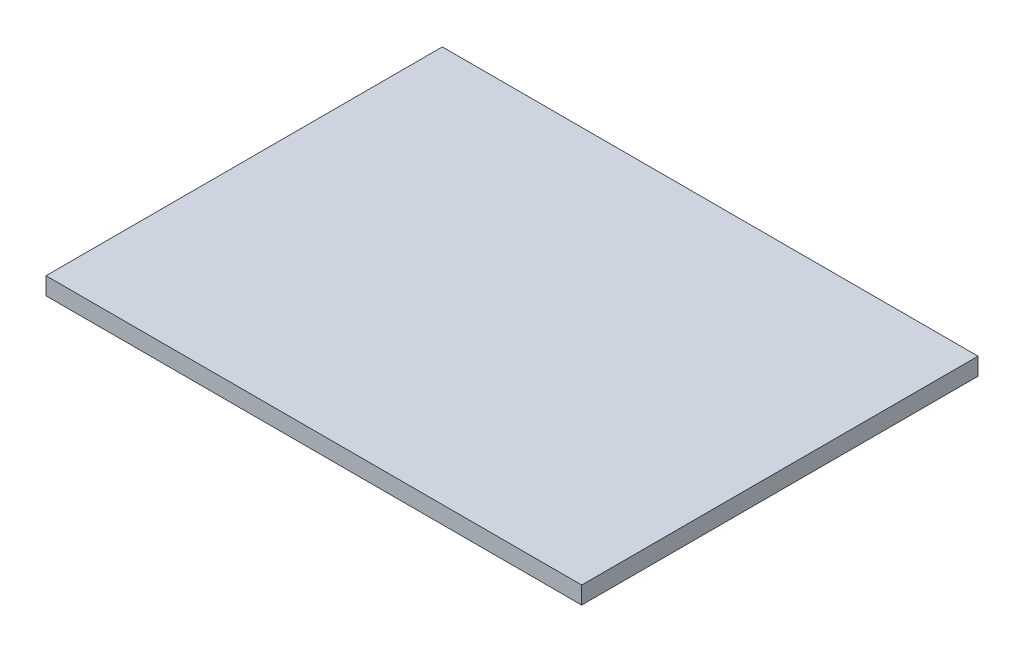
from build123d import *

# Parameters (mm, degrees)
SKETCH1_W           = 195.2625
SKETCH1_H           = 144.4625
BOSS_EXTRUDE1_DEPTH = 6.35


with BuildPart() as part:
    # Sketch1 → Boss-Extrude1 (new body)
    with BuildSketch(Plane(origin=(0, 0, 0), x_dir=(1, 0, 0), z_dir=(0, 1, 0))):
        Rectangle(SKETCH1_W, SKETCH1_H)
    extrude(amount=BOSS_EXTRUDE1_DEPTH)


solid = part.part
